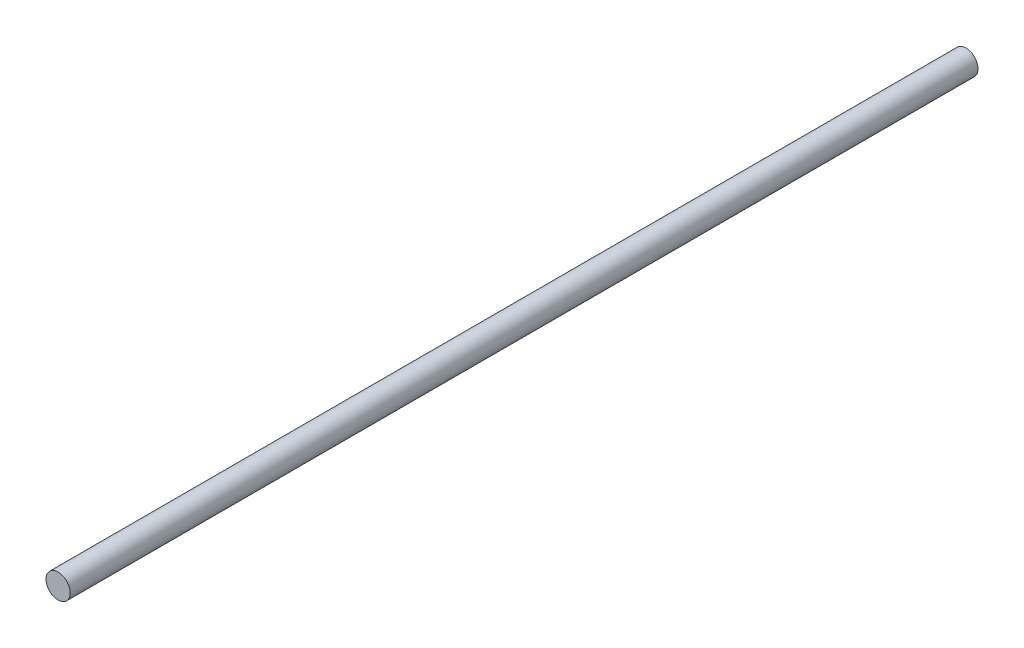
from build123d import *

# Parameters (mm, degrees)
SKETCH1_R           = 1
BOSS_EXTRUDE1_DEPTH = 75


with BuildPart() as part:
    # Sketch1 → Boss-Extrude1 (new body)
    with BuildSketch(Plane.XY):
        Circle(SKETCH1_R)
    extrude(amount=BOSS_EXTRUDE1_DEPTH)


solid = part.part
